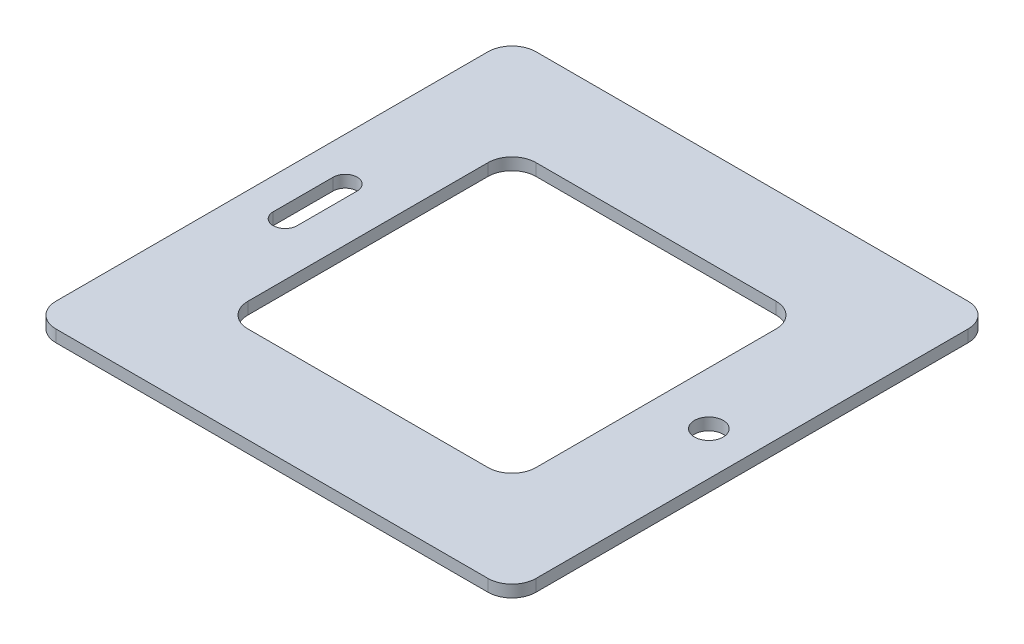
from build123d import *

# Parameters (mm, degrees)
SKETCH1_W           = 200
SKETCH1_H           = 200
BOSS_EXTRUDE1_DEPTH = 5
SKETCH2_R           = 6
CUT_EXTRUDE1_DEPTH  = 12
REDONDEO1_R         = 10


with BuildPart() as part:
    # Sketch1 → Boss-Extrude1 (new body)
    with BuildSketch(Plane(origin=(0, 0, 0), x_dir=(1, 0, 0), z_dir=(0, 1, 0))):
        Rectangle(SKETCH1_W, SKETCH1_H)
        with BuildLine():
            Line((-50, -60), (50, -60))
            ThreePointArc((50, -60), (57.071067812, -57.071067812), (60, -50))
            Line((60, -50), (60, 50))
            ThreePointArc((60, 50), (57.071067812, 57.071067812), (50, 60))
            Line((50, 60), (-50, 60))
            ThreePointArc((-50, 60), (-57.071067812, 57.071067812), (-60, 50))
            Line((-60, 50), (-60, -50))
            ThreePointArc((-60, -50), (-57.071067812, -57.071067812), (-50, -60))
        make_face(mode=Mode.SUBTRACT)
    extrude(amount=BOSS_EXTRUDE1_DEPTH)

    # Sketch2 → Cut-Extrude1 (cut)
    with BuildSketch(Plane(origin=(0, 5, 0), x_dir=(1, 0, 0), z_dir=(0, 1, 0))):
        with Locations(Location((82, 0, 0), (0, 0, 270))):
            Circle(SKETCH2_R)
        with BuildLine():
            Line((-87, -12.5), (-87, 12.5))
            ThreePointArc((-87, 12.5), (-82, 17.5), (-77, 12.5))
            Line((-77, 12.5), (-77, -12.5))
            ThreePointArc((-77, -12.5), (-82, -17.5), (-87, -12.5))
        make_face()
    extrude(amount=-CUT_EXTRUDE1_DEPTH, mode=Mode.SUBTRACT)

    # Redondeo1
    redondeo1_edges = [part.edges().sort_by_distance(p)[0] for p in [
        (100, 2.5, 100),
        (-100, 2.5, 100),
        (-100, 2.5, -100),
        (100, 2.5, -100),
    ]]
    fillet(redondeo1_edges, radius=REDONDEO1_R)


solid = part.part
